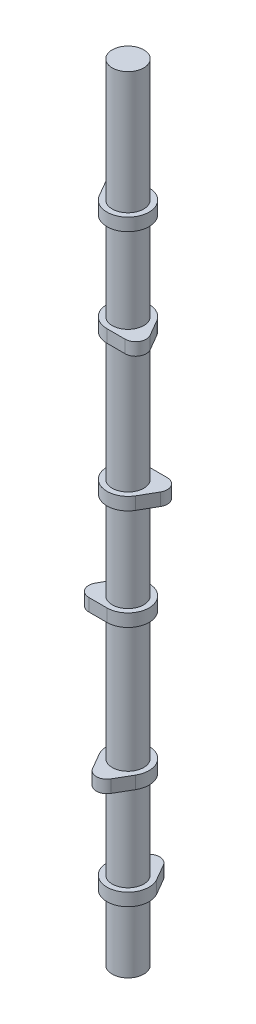
from build123d import *

# Parameters (mm, degrees)
BOSS_EXTRUDE1_DEPTH   = 3.81
BODY_MOVE_COPY2_ANGLE = 180
BOSS_EXTRUDE2_START   = -25.4
SKETCH2_R             = 9.5
BOSS_EXTRUDE2_DEPTH   = 146.05
LPATTERN1_COUNT       = 3
LPATTERN1_PITCH       = 146.05
BODY_MOVE_COPY3_ANGLE = 120
BODY_MOVE_COPY4_ANGLE = 120
BOSS_EXTRUDE3_START   = 17.94
SKETCH3_R             = 9.5
BOSS_EXTRUDE3_DEPTH   = 17.94
SKETCH4_R             = 9.5
BOSS_EXTRUDE4_DEPTH   = 17.94


with BuildPart() as part:
    # Sketch1 → Boss-Extrude1 (new, symmetric)
    with BuildSketch(Plane(origin=(0, 0, 0), x_dir=(1, 0, 0), z_dir=(0, 1, 0))):
        with BuildLine():
            Line((-5.499261314, 15.875), (-10.998522628, 6.35))
            ThreePointArc((-10.998522628, 6.35), (0, -12.7), (10.998522628, 6.35))
            Line((10.998522628, 6.35), (5.499261314, 15.875))
            ThreePointArc((5.499261314, 15.875), (0, 19.05), (-5.499261314, 15.875))
        make_face()
    extrude(amount=BOSS_EXTRUDE1_DEPTH, both=True)


with BuildPart() as body_2:
    # Body-Move/Copy1: copy of part
    add(part.part.moved(Location((0, 60.96, 0))))


with BuildPart() as body_2_1:
    # Body-Move/Copy2: moved
    add(body_2.part.rotate(Axis((0, 0, 0), (0, 1, 0)), BODY_MOVE_COPY2_ANGLE))


with BuildPart() as part_1:
    add(part.part)

    add(body_2_1.part)  # Boss-Extrude2 merges body 2
    # Sketch2 → Boss-Extrude2 (add)
    with BuildSketch(Plane(origin=(0, 0, 0), x_dir=(1, 0, 0), z_dir=(0, 1, 0)).offset(BOSS_EXTRUDE2_START)):
        Circle(SKETCH2_R)
    extrude(amount=BOSS_EXTRUDE2_DEPTH)


with BuildPart() as lpattern1_1:
    # LPattern1: pattern copy
    add(part_1.part.moved(Location(Vector(0, 1, 0) * (1 * LPATTERN1_PITCH))))


with BuildPart() as lpattern1_2:
    # LPattern1: pattern copy
    add(part_1.part.moved(Location(Vector(0, 1, 0) * (2 * LPATTERN1_PITCH))))


with BuildPart() as lpattern1_1_1:
    # Body-Move/Copy3: moved
    add(lpattern1_1.part.rotate(Axis((0, 0, 0), (0, 1, 0)), BODY_MOVE_COPY3_ANGLE))


with BuildPart() as lpattern1_2_1:
    # Body-Move/Copy4: moved
    add(lpattern1_2.part.rotate(Axis((0, 0, 0), (0, -1, 0)), BODY_MOVE_COPY4_ANGLE))


with BuildPart() as part_2:
    add(part_1.part)

    # Sketch3 → Boss-Extrude3 (add)
    with BuildSketch(Plane.XZ.offset(25.4).offset(BOSS_EXTRUDE3_START)):
        Circle(SKETCH3_R)
    extrude(amount=-BOSS_EXTRUDE3_DEPTH)

    # Combine1: union LPattern1_1, LPattern1_2
    add(lpattern1_1_1.part)
    add(lpattern1_2_1.part)

    # Sketch4 → Boss-Extrude4 (add)
    with BuildSketch(Plane(origin=(0, 412.75, 0), x_dir=(1, 0, 0), z_dir=(0, 1, 0))):
        Circle(SKETCH4_R)
    extrude(amount=BOSS_EXTRUDE4_DEPTH)


solid = part_2.part
